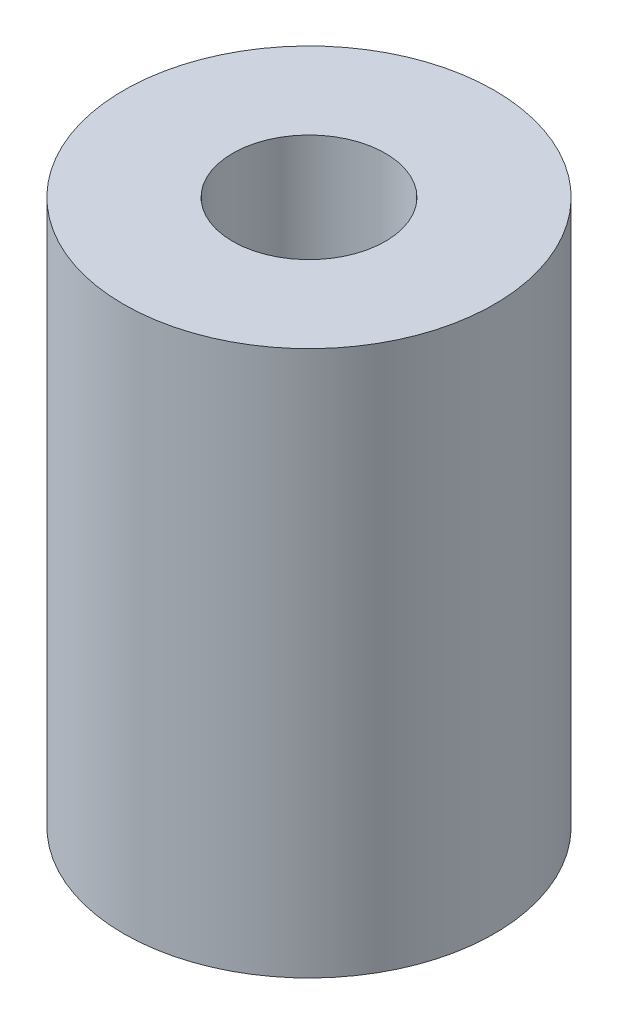
from build123d import *

# Parameters (mm, degrees)
SKETCH1_R           = 5.1016
SKETCH1_R_2         = 2.1016
BOSS_EXTRUDE1_DEPTH = 15


with BuildPart() as part:
    # Sketch1 → Boss-Extrude1 (new body)
    with BuildSketch(Plane(origin=(0, 0, 0), x_dir=(1, 0, 0), z_dir=(0, 1, 0))):
        with Locations(Location((0, 0, 0), (0, 0, 270))):
            Circle(SKETCH1_R)
        with Locations(Location((0, 0, 0), (0, 0, 270))):
            Circle(SKETCH1_R_2, mode=Mode.SUBTRACT)
    extrude(amount=BOSS_EXTRUDE1_DEPTH)


solid = part.part
